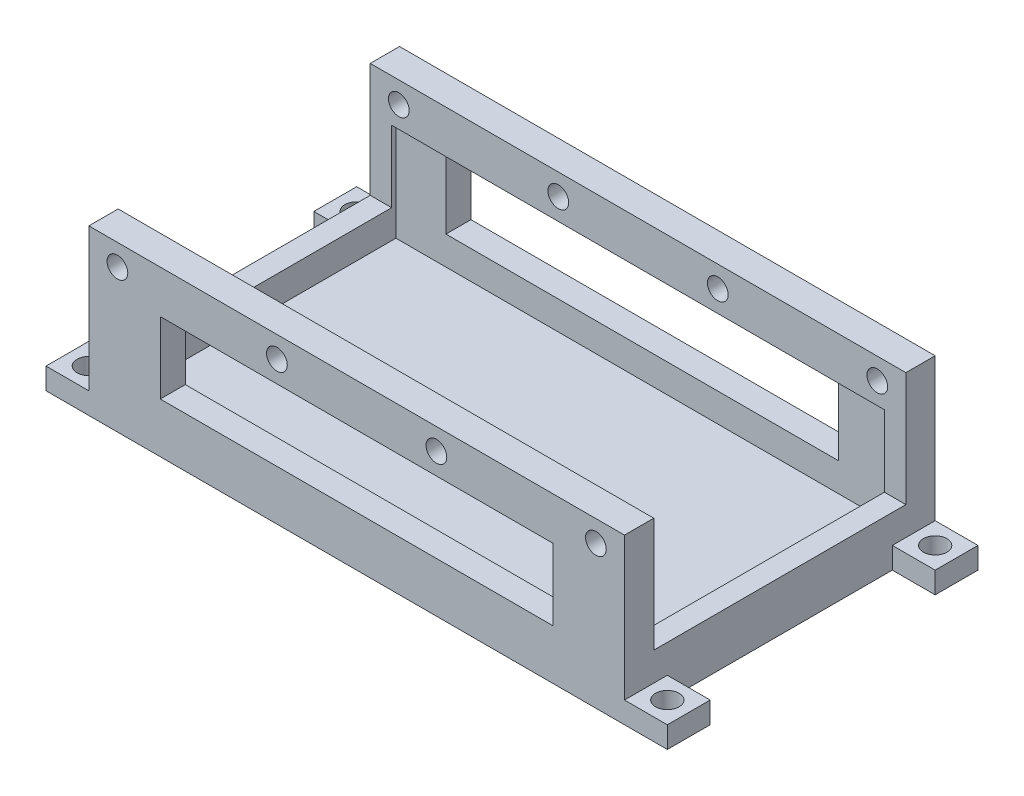
from build123d import *

# Parameters (mm, degrees)
SKETCH1_R           = 1.65
BOSS_EXTRUDE1_DEPTH = 3
SKETCH2_W           = 69
SKETCH2_H           = 36.5
BOSS_EXTRUDE2_DEPTH = 4
BOSS_EXTRUDE3_DEPTH = 10
SKETCH4_W           = 75
SKETCH4_H           = 4.1
BOSS_EXTRUDE4_DEPTH = 6
SKETCH5_R           = 1.45
CUT_EXTRUDE1_DEPTH  = 93.2239123


with BuildPart() as part:
    # Sketch1 → Boss-Extrude1 (new body)
    with BuildSketch(Plane(origin=(0, 0, 0), x_dir=(1, 0, 0), z_dir=(0, 1, 0))):
        Polygon((-78, 39.5), (-78, 33.5), (-72, 33.5), (-72, 2), (-78, 2), (-78, -4), (9, -4), (9, 2), (3, 2), (3, 33.5), (9, 33.5), (9, 39.5), align=None)
        with Locations(Location((-75, 36.5, 0), (0, 0, 270))):
            Circle(SKETCH1_R, mode=Mode.SUBTRACT)
        with Locations(Location((6, 36.5, 0), (0, 0, 270))):
            Circle(SKETCH1_R, mode=Mode.SUBTRACT)
        with Locations(Location((-75, -1, 0), (0, 0, 270))):
            Circle(SKETCH1_R, mode=Mode.SUBTRACT)
        with Locations(Location((6, -1, 0), (0, 0, 270))):
            Circle(SKETCH1_R, mode=Mode.SUBTRACT)
    extrude(amount=BOSS_EXTRUDE1_DEPTH)

    # Sketch2 → Boss-Extrude2 (add)
    with BuildSketch(Plane(origin=(0, 3, 0), x_dir=(1, 0, 0), z_dir=(0, 1, 0))):
        Polygon((-72, 39.5), (-72, 33.5), (-72, 2), (-72, -4), (3, -4), (3, 2), (3, 33.5), (3, 39.5), align=None)
        with Locations((-34.5, 17.75)):
            Rectangle(SKETCH2_W, SKETCH2_H, mode=Mode.SUBTRACT)
    extrude(amount=BOSS_EXTRUDE2_DEPTH)

    # Sketch3 → Boss-Extrude3 (add)
    with BuildSketch(Plane(origin=(0, 7, 0), x_dir=(1, 0, 0), z_dir=(0, 1, 0))):
        Polygon((3, -4), (3, 0.1), (0, 0.1), (0, -0.5), (-7, -0.5), (-7, -4), align=None)
        Polygon((3, 39.5), (-7, 39.5), (-7, 36), (0, 36), (0, 35.4), (3, 35.4), align=None)
        Polygon((-72, 39.5), (-72, 35.4), (-69, 35.4), (-69, 36), (-62, 36), (-62, 39.5), align=None)
        Polygon((-72, -4), (-62, -4), (-62, -0.5), (-69, -0.5), (-69, 0.1), (-72, 0.1), align=None)
    extrude(amount=BOSS_EXTRUDE3_DEPTH)

    # Sketch4 → Boss-Extrude4 (add)
    with BuildSketch(Plane(origin=(0, 17, 0), x_dir=(1, 0, 0), z_dir=(0, 1, 0))):
        with Locations((-34.5, 37.45)):
            Rectangle(SKETCH4_W, SKETCH4_H)
        with Locations((-34.5, -1.95)):
            Rectangle(SKETCH4_W, SKETCH4_H)
    extrude(amount=BOSS_EXTRUDE4_DEPTH)

    # Sketch5 → Cut-Extrude1 (cut, through all)
    with BuildSketch(Plane.XY.offset(4)):
        with Locations((-68, 20)):
            Circle(SKETCH5_R)
        with Locations((-45.666666667, 20)):
            Circle(SKETCH5_R)
        with Locations((-23.333333333, 20)):
            Circle(SKETCH5_R)
        with Locations((-1, 20)):
            Circle(SKETCH5_R)
    extrude(amount=-CUT_EXTRUDE1_DEPTH, mode=Mode.SUBTRACT)


solid = part.part
